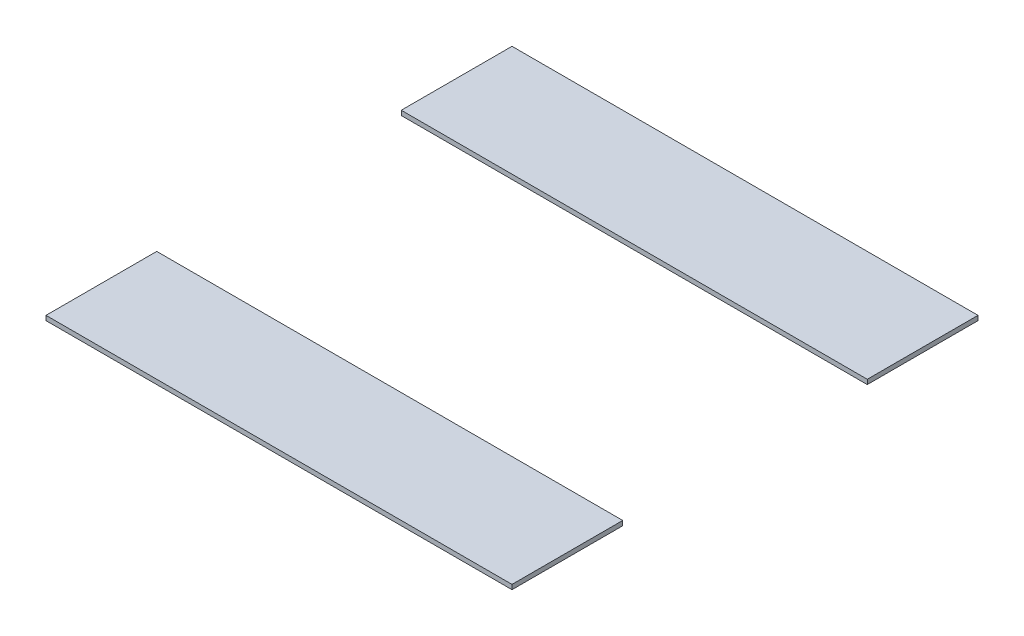
from build123d import *

# Parameters (mm, degrees)
SKETCH1_W           = 202
SKETCH1_H           = 202
BOSS_EXTRUDE1_DEPTH = 2
SKETCH2_W           = 202
SKETCH2_H           = 106
CUT_EXTRUDE2_DEPTH  = 2


with BuildPart() as part:
    # Sketch1 → Boss-Extrude1 (new body)
    with BuildSketch(Plane(origin=(0, 0, 0), x_dir=(1, 0, 0), z_dir=(0, 1, 0))):
        Rectangle(SKETCH1_W, SKETCH1_H)
    extrude(amount=BOSS_EXTRUDE1_DEPTH)

    # Sketch2 → Cut-Extrude2 (cut)
    with BuildSketch(Plane(origin=(0, 0, 0), x_dir=(1, 0, 0), z_dir=(0, 1, 0))):
        Rectangle(SKETCH2_W, SKETCH2_H)
    extrude(amount=CUT_EXTRUDE2_DEPTH, mode=Mode.SUBTRACT)


with BuildPart() as cut_extrude2_piece_1:
    # of the separate pieces the step leaves, piece 1, a body of its own (cut_extrude2_pieces)
    add(part.part.solids().sort_by_distance((-101, 0, -101))[0])


with BuildPart() as cut_extrude2_piece_2:
    # of the separate pieces the step leaves, piece 2, a body of its own (cut_extrude2_pieces)
    add(part.part.solids().sort_by_distance((-101, 0, 101))[0])


solid = Compound([cut_extrude2_piece_1.part, cut_extrude2_piece_2.part])
